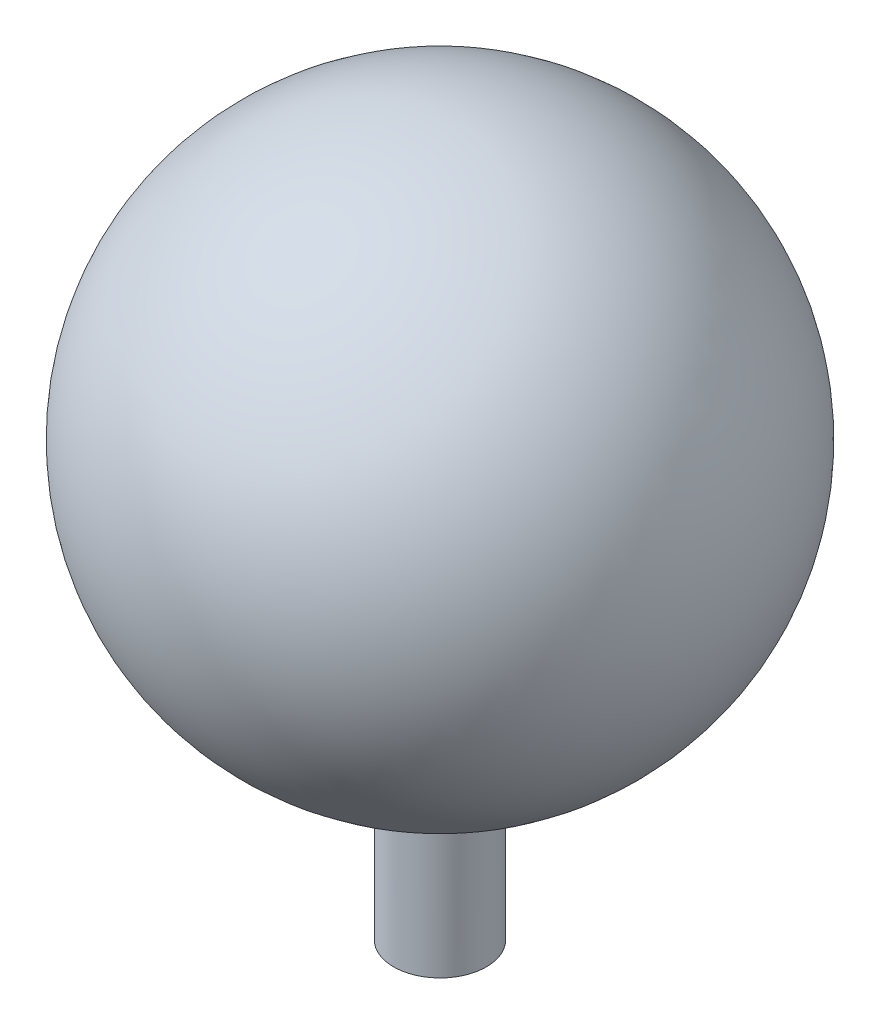
from build123d import *


with BuildPart() as part:
    # Sketch1 → Revolve4 (revolve)
    with BuildSketch(Plane.XY):
        with BuildLine():
            Line((0, 4.5), (0, -7))
            Line((0, -7), (0.75, -7))
            Line((0.75, -7), (0.75, -4.437059837))
            ThreePointArc((0.75, -4.437059837), (4.484237353, 0.376318171), (0, 4.5))
        make_face()
    revolve(axis=Axis((0, 4.5, 0), (0, -1, 0)))


solid = part.part
